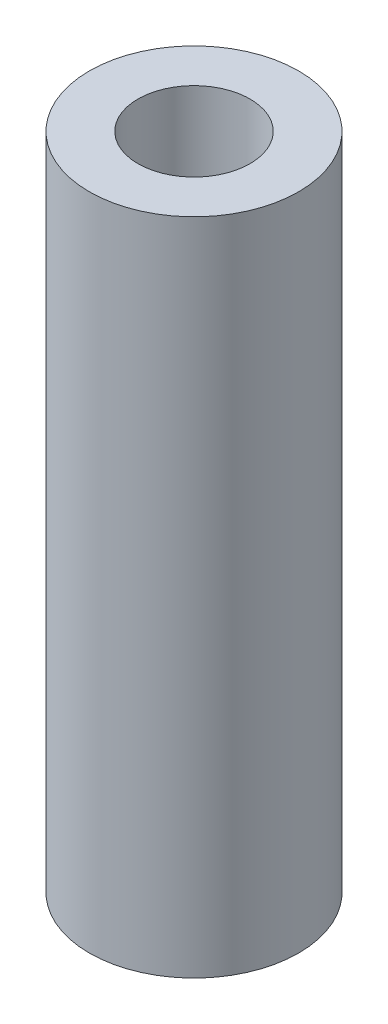
from build123d import *

# Parameters (mm, degrees)
SKETCH1_R            = 3.175
BOSS_EXTRUDE1_DEPTH  = 20
M3_CLEARANCE_HOLE1_D = 3.4


with BuildPart() as part:
    # Sketch1 → Boss-Extrude1 (new body)
    with BuildSketch(Plane(origin=(0, 0, 0), x_dir=(1, 0, 0), z_dir=(0, 1, 0))):
        with Locations(Location((0, 0, 0), (0, 0, 270))):
            Circle(SKETCH1_R)
    extrude(amount=BOSS_EXTRUDE1_DEPTH)

    # M3 Clearance Hole1 (through all)
    with Locations(Plane(origin=(0, 20, 0), x_dir=(1, 0, 0), z_dir=(0, 1, 0))):
        with Locations((0, 0)):
            Hole(M3_CLEARANCE_HOLE1_D / 2)


solid = part.part
